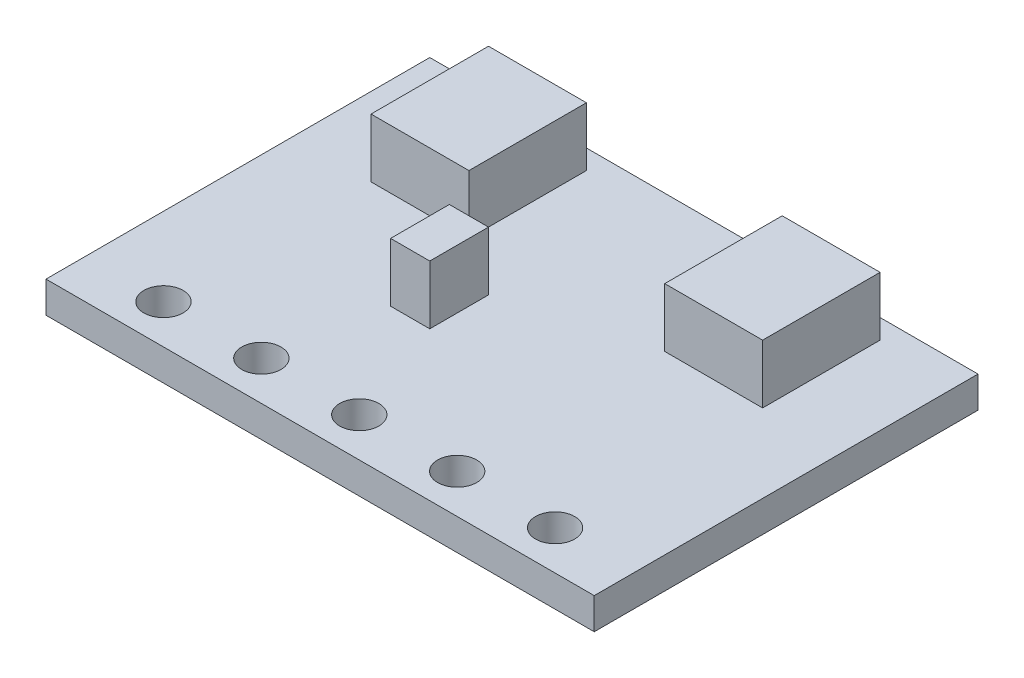
from build123d import *

# Parameters (mm, degrees)
SKETCH1_W           = 14
SKETCH1_H           = 9.8
BOSS_EXTRUDE1_DEPTH = 3.3
SKETCH2_W           = 14
SKETCH2_H           = 9.8
SKETCH2_W_2         = 2.5
SKETCH2_H_2         = 3
SKETCH2_W_3         = 1
SKETCH2_H_3         = 1.5
CUT_EXTRUDE1_DEPTH  = 1.5
SKETCH3_W           = 14
SKETCH3_H           = 9.8
SKETCH3_W_2         = 1
SKETCH3_H_2         = 2
CUT_EXTRUDE2_DEPTH  = 1
SKETCH4_R           = 0.5
CUT_EXTRUDE3_DEPTH  = 1


with BuildPart() as part:
    # Sketch1 → Boss-Extrude1 (new body)
    with BuildSketch(Plane(origin=(0, 0, 0), x_dir=(1, 0, 0), z_dir=(0, 1, 0))):
        Rectangle(SKETCH1_W, SKETCH1_H)
    extrude(amount=BOSS_EXTRUDE1_DEPTH)

    # Sketch2 → Cut-Extrude1 (cut)
    with BuildSketch(Plane(origin=(0, 3.3, 0), x_dir=(1, 0, 0), z_dir=(0, 1, 0))):
        Rectangle(SKETCH2_W, SKETCH2_H)
        with Locations((-3.75, 2.9)):
            Rectangle(SKETCH2_W_2, SKETCH2_H_2, mode=Mode.SUBTRACT)
        with Locations((3.75, 2.9)):
            Rectangle(SKETCH2_W_2, SKETCH2_H_2, mode=Mode.SUBTRACT)
        with Locations((-1.5, -0.35)):
            Rectangle(SKETCH2_W_3, SKETCH2_H_3, mode=Mode.SUBTRACT)
    extrude(amount=-CUT_EXTRUDE1_DEPTH, mode=Mode.SUBTRACT)

    # Sketch3 → Cut-Extrude2 (cut)
    with BuildSketch(Plane.XZ):
        Rectangle(SKETCH3_W, SKETCH3_H)
        with Locations((-6, -1.4)):
            Rectangle(SKETCH3_W_2, SKETCH3_H_2, mode=Mode.SUBTRACT)
    extrude(amount=-CUT_EXTRUDE2_DEPTH, mode=Mode.SUBTRACT)

    # Sketch4 → Cut-Extrude3 (cut)
    with BuildSketch(Plane.XZ.offset(-1)):
        with Locations(Location((-5, 3.9, 0), (0, 0, 270))):
            Circle(SKETCH4_R)
        with Locations(Location((-2.5, 3.9, 0), (0, 0, 270))):
            Circle(SKETCH4_R)
        with Locations(Location((0, 3.9, 0), (0, 0, 270))):
            Circle(SKETCH4_R)
        with Locations(Location((2.5, 3.9, 0), (0, 0, 270))):
            Circle(SKETCH4_R)
        with Locations(Location((5, 3.9, 0), (0, 0, 270))):
            Circle(SKETCH4_R)
    extrude(amount=-CUT_EXTRUDE3_DEPTH, mode=Mode.SUBTRACT)


solid = part.part
